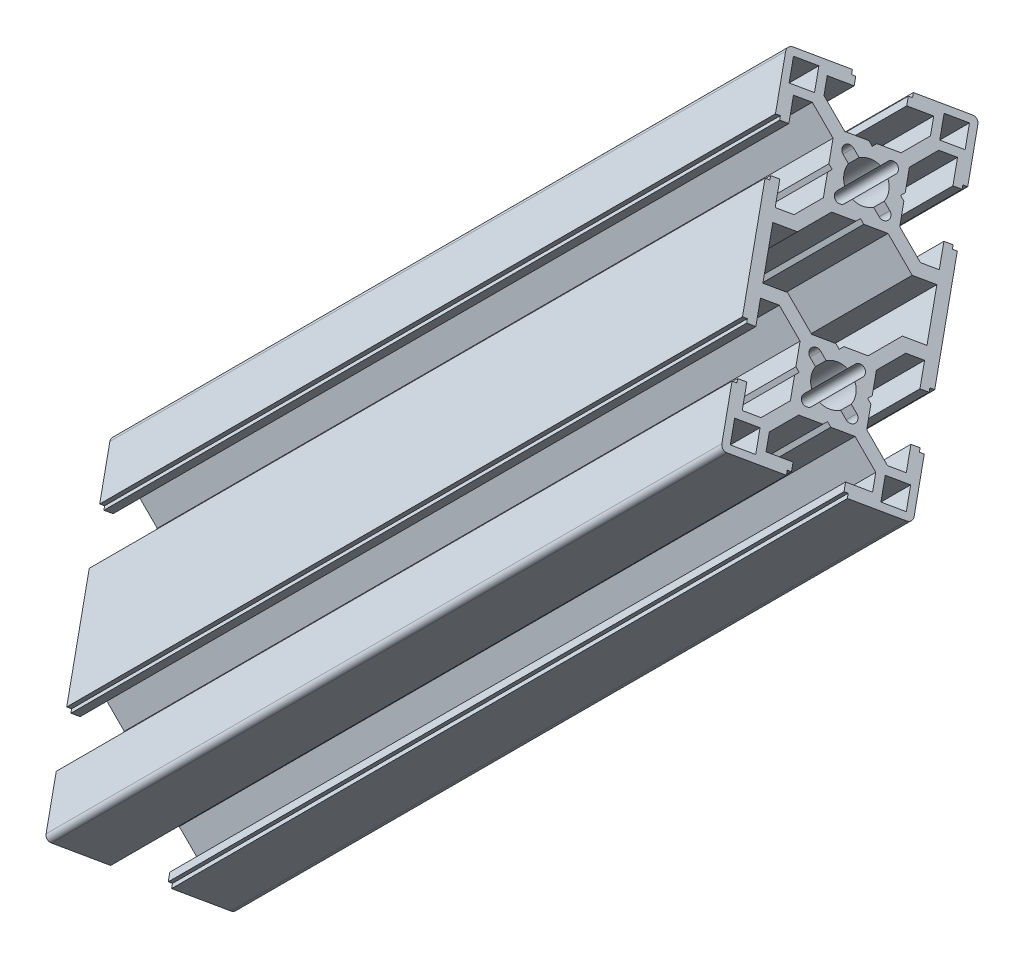
from build123d import *

# Parameters (mm, degrees)
SKETCH2_W                  = 3.960773678
SKETCH2_H                  = 3.960773678
T_SLOT_CNCCAT_3060_1_DEPTH = 180


with BuildPart() as part:
    # Sketch2 → T-slot CNCCAT-3060(1) (new body)
    with BuildSketch(Plane(origin=(0, 0, 0), x_dir=(0.5000000000000017, -0.49999999999999994, 0.7071067811865464), z_dir=(-0.7071067811865464, -0.7071067811865488, 0))):
        with BuildLine():
            Line((-20.337121873, 0), (-20.956716316, -0.619594443))
            Line((-20.956716316, -0.619594443), (-20.956716316, -4.401081398))
            Line((-20.956716316, -4.401081398), (-24.863654578, -8.30801966))
            Line((-24.863654578, -8.30801966), (-27.8, -8.30801966))
            Line((-27.8, -8.30801966), (-27.8, -4.1))
            Line((-27.8, -4.1), (-29.233870922, -4.1))
            Line((-29.233870922, -4.1), (-29.233870922, -4.756280561))
            Line((-29.233870922, -4.756280561), (-30, -4.756280561))
            Line((-30, -4.756280561), (-30, -14))
            ThreePointArc((-30, -14), (-29.707106781, -14.707106781), (-29, -15))
            Line((-29, -15), (-19.756280561, -15))
            Line((-19.756280561, -15), (-19.756280561, -14.233870922))
            Line((-19.756280561, -14.233870922), (-19.1, -14.233870922))
            Line((-19.1, -14.233870922), (-19.1, -12.8))
            Line((-19.1, -12.8), (-23.30801966, -12.8))
            Line((-23.30801966, -12.8), (-23.30801966, -9.863654578))
            Line((-23.30801966, -9.863654578), (-19.401081398, -5.956716316))
            Line((-19.401081398, -5.956716316), (-15.619594443, -5.956716316))
            Line((-15.619594443, -5.956716316), (-15, -5.337121873))
            Line((-15, -5.337121873), (-14.380405557, -5.956716316))
            Line((-14.380405557, -5.956716316), (-10.598918602, -5.956716316))
            Line((-10.598918602, -5.956716316), (-6.69198034, -9.863654578))
            Line((-6.69198034, -9.863654578), (-6.69198034, -12.8))
            Line((-6.69198034, -12.8), (-10.9, -12.8))
            Line((-10.9, -12.8), (-10.9, -14.233870922))
            Line((-10.9, -14.233870922), (-10.243719439, -14.233870922))
            Line((-10.243719439, -14.233870922), (-10.243719439, -15))
            Line((-10.243719439, -15), (10.243719439, -15))
            Line((10.243719439, -15), (10.243719439, -14.233870922))
            Line((10.243719439, -14.233870922), (10.9, -14.233870922))
            Line((10.9, -14.233870922), (10.9, -12.8))
            Line((10.9, -12.8), (6.69198034, -12.8))
            Line((6.69198034, -12.8), (6.69198034, -9.863654578))
            Line((6.69198034, -9.863654578), (10.598918602, -5.956716316))
            Line((10.598918602, -5.956716316), (14.380405557, -5.956716316))
            Line((14.380405557, -5.956716316), (15, -5.337121873))
            Line((15, -5.337121873), (15.619594443, -5.956716316))
            Line((15.619594443, -5.956716316), (19.401081398, -5.956716316))
            Line((19.401081398, -5.956716316), (23.30801966, -9.863654578))
            Line((23.30801966, -9.863654578), (23.30801966, -12.8))
            Line((23.30801966, -12.8), (19.1, -12.8))
            Line((19.1, -12.8), (19.1, -14.233870922))
            Line((19.1, -14.233870922), (19.756280561, -14.233870922))
            Line((19.756280561, -14.233870922), (19.756280561, -15))
            Line((19.756280561, -15), (29, -15))
            ThreePointArc((29, -15), (29.707106781, -14.707106781), (30, -14))
            Line((30, -14), (30, -4.756280561))
            Line((30, -4.756280561), (29.233870922, -4.756280561))
            Line((29.233870922, -4.756280561), (29.233870922, -4.1))
            Line((29.233870922, -4.1), (27.8, -4.1))
            Line((27.8, -4.1), (27.8, -8.30801966))
            Line((27.8, -8.30801966), (24.863654578, -8.30801966))
            Line((24.863654578, -8.30801966), (20.956716316, -4.401081398))
            Line((20.956716316, -4.401081398), (20.956716316, -0.619594443))
            Line((20.956716316, -0.619594443), (20.337121873, 0))
            Line((20.337121873, 0), (20.956716316, 0.619594443))
            Line((20.956716316, 0.619594443), (20.956716316, 4.401081398))
            Line((20.956716316, 4.401081398), (24.863654578, 8.30801966))
            Line((24.863654578, 8.30801966), (27.8, 8.30801966))
            Line((27.8, 8.30801966), (27.8, 4.1))
            Line((27.8, 4.1), (29.233870922, 4.1))
            Line((29.233870922, 4.1), (29.233870922, 4.756280561))
            Line((29.233870922, 4.756280561), (30, 4.756280561))
            Line((30, 4.756280561), (30, 14))
            ThreePointArc((30, 14), (29.707106781, 14.707106781), (29, 15))
            Line((29, 15), (19.756280561, 15))
            Line((19.756280561, 15), (19.756280561, 14.233870922))
            Line((19.756280561, 14.233870922), (19.1, 14.233870922))
            Line((19.1, 14.233870922), (19.1, 12.8))
            Line((19.1, 12.8), (23.30801966, 12.8))
            Line((23.30801966, 12.8), (23.30801966, 9.863654578))
            Line((23.30801966, 9.863654578), (19.401081398, 5.956716316))
            Line((19.401081398, 5.956716316), (15.619594443, 5.956716316))
            Line((15.619594443, 5.956716316), (15, 5.337121873))
            Line((15, 5.337121873), (14.380405557, 5.956716316))
            Line((14.380405557, 5.956716316), (10.598918602, 5.956716316))
            Line((10.598918602, 5.956716316), (6.69198034, 9.863654578))
            Line((6.69198034, 9.863654578), (6.69198034, 12.8))
            Line((6.69198034, 12.8), (10.9, 12.8))
            Line((10.9, 12.8), (10.9, 14.233870922))
            Line((10.9, 14.233870922), (10.243719439, 14.233870922))
            Line((10.243719439, 14.233870922), (10.243719439, 15))
            Line((10.243719439, 15), (-10.243719439, 15))
            Line((-10.243719439, 15), (-10.243719439, 14.233870922))
            Line((-10.243719439, 14.233870922), (-10.9, 14.233870922))
            Line((-10.9, 14.233870922), (-10.9, 12.8))
            Line((-10.9, 12.8), (-6.69198034, 12.8))
            Line((-6.69198034, 12.8), (-6.69198034, 9.863654578))
            Line((-6.69198034, 9.863654578), (-10.598918602, 5.956716316))
            Line((-10.598918602, 5.956716316), (-14.380405557, 5.956716316))
            Line((-14.380405557, 5.956716316), (-15, 5.337121873))
            Line((-15, 5.337121873), (-15.619594443, 5.956716316))
            Line((-15.619594443, 5.956716316), (-19.401081398, 5.956716316))
            Line((-19.401081398, 5.956716316), (-23.30801966, 9.863654578))
            Line((-23.30801966, 9.863654578), (-23.30801966, 12.8))
            Line((-23.30801966, 12.8), (-19.1, 12.8))
            Line((-19.1, 12.8), (-19.1, 14.233870922))
            Line((-19.1, 14.233870922), (-19.756280561, 14.233870922))
            Line((-19.756280561, 14.233870922), (-19.756280561, 15))
            Line((-19.756280561, 15), (-29, 15))
            ThreePointArc((-29, 15), (-29.707106781, 14.707106781), (-30, 14))
            Line((-30, 14), (-30, 4.756280561))
            Line((-30, 4.756280561), (-29.233870922, 4.756280561))
            Line((-29.233870922, 4.756280561), (-29.233870922, 4.1))
            Line((-29.233870922, 4.1), (-27.8, 4.1))
            Line((-27.8, 4.1), (-27.8, 8.30801966))
            Line((-27.8, 8.30801966), (-24.863654578, 8.30801966))
            Line((-24.863654578, 8.30801966), (-20.956716316, 4.401081398))
            Line((-20.956716316, 4.401081398), (-20.956716316, 0.619594443))
            Line((-20.956716316, 0.619594443), (-20.337121873, 0))
        make_face()
        with Locations((26.75, 11.75)):
            Rectangle(SKETCH2_W, SKETCH2_H, mode=Mode.SUBTRACT)
        with BuildLine():
            Line((19.109450474, -2.695236912), (18.078815026, -1.664601464))
            ThreePointArc((18.078815026, -1.664601464), (18.5, 0), (18.078815026, 1.664601464))
            Line((18.078815026, 1.664601464), (19.109450474, 2.695236912))
            ThreePointArc((19.109450474, 2.695236912), (19.109450474, 4.109450474), (17.695236912, 4.109450474))
            Line((17.695236912, 4.109450474), (16.664601464, 3.078815026))
            ThreePointArc((16.664601464, 3.078815026), (15, 3.5), (13.335398536, 3.078815026))
            Line((13.335398536, 3.078815026), (12.304763088, 4.109450474))
            ThreePointArc((12.304763088, 4.109450474), (10.890549526, 4.109450474), (10.890549526, 2.695236912))
            Line((10.890549526, 2.695236912), (11.921184974, 1.664601464))
            ThreePointArc((11.921184974, 1.664601464), (11.5, 0), (11.921184974, -1.664601464))
            Line((11.921184974, -1.664601464), (10.890549526, -2.695236912))
            ThreePointArc((10.890549526, -2.695236912), (10.890549526, -4.109450474), (12.304763088, -4.109450474))
            Line((12.304763088, -4.109450474), (13.335398536, -3.078815026))
            ThreePointArc((13.335398536, -3.078815026), (15, -3.5), (16.664601464, -3.078815026))
            Line((16.664601464, -3.078815026), (17.695236912, -4.109450474))
            ThreePointArc((17.695236912, -4.109450474), (19.109450474, -4.109450474), (19.109450474, -2.695236912))
        make_face(mode=Mode.SUBTRACT)
        Polygon((-4.49198034, -12.8), (4.49198034, -12.8), (4.49198034, -8.952384741), (9.043283684, -4.401081398), (9.043283684, -0.619594443), (9.662878127, 0), (9.043283684, 0.619594443), (9.043283684, 4.401081398), (4.49198034, 8.952384741), (4.49198034, 12.8), (-4.49198034, 12.8), (-4.49198034, 8.952384741), (-9.043283684, 4.401081398), (-9.043283684, 0.619594443), (-9.662878127, 0), (-9.043283684, -0.619594443), (-9.043283684, -4.401081398), (-4.49198034, -8.952384741), align=None, mode=Mode.SUBTRACT)
        with Locations((26.75, -11.75)):
            Rectangle(SKETCH2_W, SKETCH2_H, mode=Mode.SUBTRACT)
        with Locations((-26.75, 11.75)):
            Rectangle(SKETCH2_W, SKETCH2_H, mode=Mode.SUBTRACT)
        with BuildLine():
            Line((-19.109450474, 2.695236912), (-18.078815026, 1.664601464))
            ThreePointArc((-18.078815026, 1.664601464), (-18.5, 0), (-18.078815026, -1.664601464))
            Line((-18.078815026, -1.664601464), (-19.109450474, -2.695236912))
            ThreePointArc((-19.109450474, -2.695236912), (-19.109450474, -4.109450474), (-17.695236912, -4.109450474))
            Line((-17.695236912, -4.109450474), (-16.664601464, -3.078815026))
            ThreePointArc((-16.664601464, -3.078815026), (-15, -3.5), (-13.335398536, -3.078815026))
            Line((-13.335398536, -3.078815026), (-12.304763088, -4.109450474))
            ThreePointArc((-12.304763088, -4.109450474), (-10.890549526, -4.109450474), (-10.890549526, -2.695236912))
            Line((-10.890549526, -2.695236912), (-11.921184974, -1.664601464))
            ThreePointArc((-11.921184974, -1.664601464), (-11.5, 0), (-11.921184974, 1.664601464))
            Line((-11.921184974, 1.664601464), (-10.890549526, 2.695236912))
            ThreePointArc((-10.890549526, 2.695236912), (-10.890549526, 4.109450474), (-12.304763088, 4.109450474))
            Line((-12.304763088, 4.109450474), (-13.335398536, 3.078815026))
            ThreePointArc((-13.335398536, 3.078815026), (-15, 3.5), (-16.664601464, 3.078815026))
            Line((-16.664601464, 3.078815026), (-17.695236912, 4.109450474))
            ThreePointArc((-17.695236912, 4.109450474), (-19.109450474, 4.109450474), (-19.109450474, 2.695236912))
        make_face(mode=Mode.SUBTRACT)
        with Locations((-26.75, -11.75)):
            Rectangle(SKETCH2_W, SKETCH2_H, mode=Mode.SUBTRACT)
    extrude(amount=T_SLOT_CNCCAT_3060_1_DEPTH)


solid = part.part
